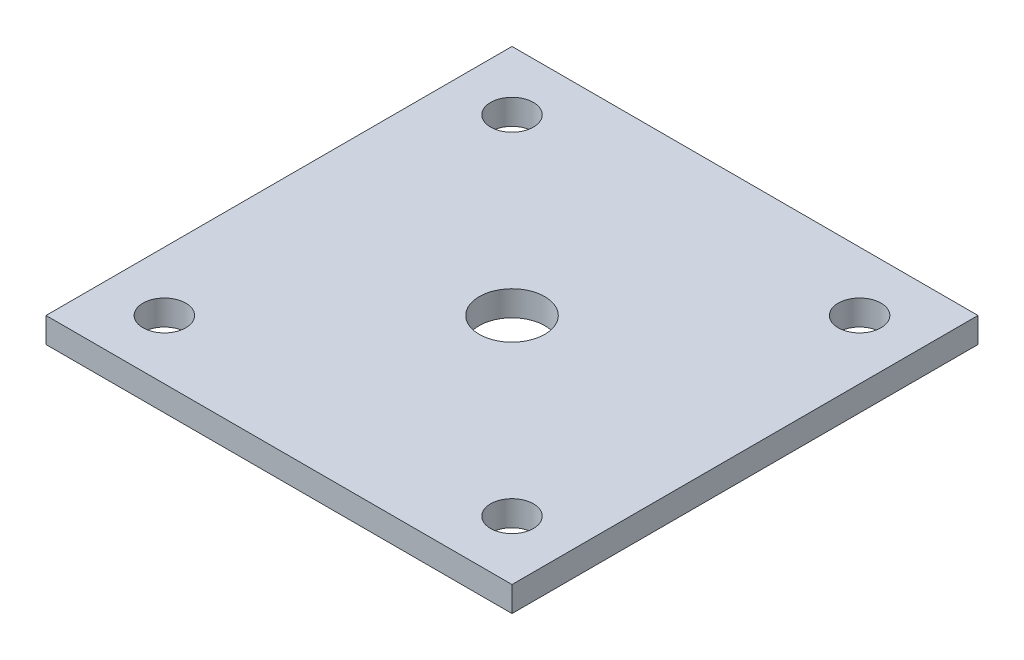
from build123d import *

# Parameters (mm, degrees)
SKETCH1_W           = 46.99
SKETCH1_H           = 46.99
SKETCH1_R           = 2.159
SKETCH1_R_2         = 3.302
BOSS_EXTRUDE1_DEPTH = 2.54


with BuildPart() as part:
    # Sketch1 → Boss-Extrude1 (new body)
    with BuildSketch(Plane(origin=(0, 0, 0), x_dir=(1, 0, 0), z_dir=(0, 1, 0))):
        Rectangle(SKETCH1_W, SKETCH1_H)
        with Locations(Location((-17.526, 17.526, 0), (0, 0, 270))):
            Circle(SKETCH1_R, mode=Mode.SUBTRACT)
        with Locations(Location((17.526, 17.526, 0), (0, 0, 270))):
            Circle(SKETCH1_R, mode=Mode.SUBTRACT)
        with Locations(Location((-17.526, -17.526, 0), (0, 0, 270))):
            Circle(SKETCH1_R, mode=Mode.SUBTRACT)
        with Locations(Location((17.526, -17.526, 0), (0, 0, 270))):
            Circle(SKETCH1_R, mode=Mode.SUBTRACT)
        with Locations(Location((0, 0, 0), (0, 0, 270))):
            Circle(SKETCH1_R_2, mode=Mode.SUBTRACT)
    extrude(amount=BOSS_EXTRUDE1_DEPTH)


solid = part.part
